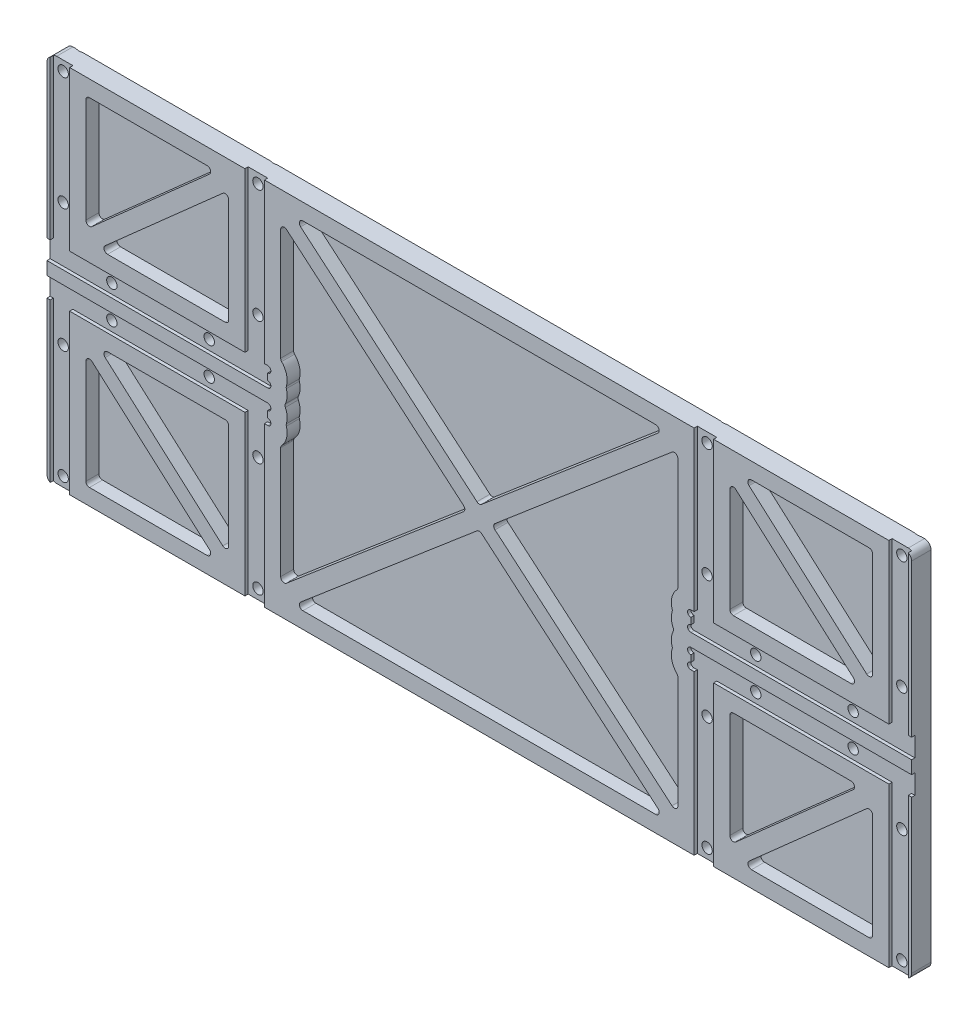
from build123d import *

# Parameters (mm, degrees)
SKETCH_1_W                   = 133.183849372
SKETCH_1_H                   = 57
EXTRUDE_1_DEPTH              = 6
CUT_EXTRUDE_1_DEPTH          = 1
HOLE_WIZARD_M3_1_D           = 3.2
HOLE_WIZARD_M3_1_CSINK_D     = 6.3
HOLE_WIZARD_M3_1_CSINK_ANGLE = 90
MIRROR_5_COPY_1_SKETCH_W     = 133.183849372
MIRROR_5_COPY_1_SKETCH_H     = 57
MIRROR_5_COPY_1_DEPTH        = 6
MIRROR_5_COPY_2_DEPTH        = 1
MIRROR_5_COPY_3_D            = 3.2
MIRROR_5_COPY_3_CSINK_D      = 6.3
MIRROR_5_COPY_3_CSINK_ANGLE  = 90
FILLET_1_R                   = 2
CUT_EXTRUDE_2_DEPTH          = 4
FILLET_2_R                   = 1.1


with BuildPart() as part:
    # ｽｹｯﾁ1 → ﾎﾞｽ - 押し出し1 (new body)
    with BuildSketch(Plane.XY):
        with Locations((-66.591924686, 28.5)):
            Rectangle(SKETCH_1_W, SKETCH_1_H)
    extrude_1 = extrude(amount=-EXTRUDE_1_DEPTH)

    # ｽｹｯﾁ1<3> → ｶｯﾄ - 押し出し1 (cut)
    with BuildSketch(Plane.XY):
        with BuildLine():
            Line((-126.183849372, 57), (-132.183849372, 57))
            Line((-132.183849372, 57), (-132.183849372, 8))
            Line((-132.183849372, 8), (-133.183849372, 8))
            Line((-133.183849372, 8), (-133.183849372, 2))
            Line((-133.183849372, 2), (-65.183849372, 2))
            ThreePointArc((-65.183849372, 2), (-64.183849372, 3), (-65.183849372, 4))
            Line((-65.183849372, 4), (-65.183849372, 6))
            ThreePointArc((-65.183849372, 6), (-64.183849372, 7), (-65.183849372, 8))
            Line((-65.183849372, 8), (-66.183849372, 8))
            Line((-66.183849372, 8), (-66.183849372, 57))
            Line((-66.183849372, 57), (-72.183849372, 57))
            Line((-72.183849372, 57), (-72.183849372, 8))
            Line((-72.183849372, 8), (-126.183849372, 8))
            Line((-126.183849372, 8), (-126.183849372, 57))
        make_face()
    cut_extrude_1 = extrude(amount=-CUT_EXTRUDE_1_DEPTH, mode=Mode.SUBTRACT)

    # M3 丸皿ねじ用皿穴1 (through all)
    with Locations(Plane(origin=(-129.183849372, 54, -6), x_dir=(-1, 0, 0), z_dir=(0, 0, -1))):
        with Locations((0, 0), (0, -35), (-15, -49), (-45, -49), (-60, -35), (-60, 0)):
            hole_wizard_m3_1 = CounterSinkHole(HOLE_WIZARD_M3_1_D / 2, HOLE_WIZARD_M3_1_CSINK_D / 2, counter_sink_angle=HOLE_WIZARD_M3_1_CSINK_ANGLE)

    # ﾐﾗｰ4: ﾎﾞｽ - 押し出し1, ｶｯﾄ - 押し出し1, M3 丸皿ねじ用皿穴1 across plane
    add(extrude_1.mirror(Plane.ZX))
    add(cut_extrude_1.mirror(Plane.ZX), mode=Mode.SUBTRACT)
    add(hole_wizard_m3_1.mirror(Plane.ZX), mode=Mode.SUBTRACT)

    # ﾐﾗｰ5: ﾎﾞｽ - 押し出し1, ｶｯﾄ - 押し出し1, M3 丸皿ねじ用皿穴1 across plane
    add(extrude_1.mirror(Plane(origin=(0, 0, 0), x_dir=(0, 0, 1), z_dir=(1, 0, 0))))
    add(cut_extrude_1.mirror(Plane(origin=(0, 0, 0), x_dir=(0, 0, 1), z_dir=(1, 0, 0))), mode=Mode.SUBTRACT)
    add(hole_wizard_m3_1.mirror(Plane(origin=(0, 0, 0), x_dir=(0, 0, 1), z_dir=(1, 0, 0))), mode=Mode.SUBTRACT)

    # ﾐﾗｰ5 copy 1 sketch → ﾐﾗｰ5 copy 1 (add)
    with BuildSketch(Plane(origin=(0, 0, 0), x_dir=(-1, 0, 0), z_dir=(0, 0, 1))):
        with Locations((-66.591924686, 28.5)):
            Rectangle(MIRROR_5_COPY_1_SKETCH_W, MIRROR_5_COPY_1_SKETCH_H)
    extrude(amount=-MIRROR_5_COPY_1_DEPTH)

    # ﾐﾗｰ5 copy 2 sketch → ﾐﾗｰ5 copy 2 (cut)
    with BuildSketch(Plane(origin=(0, 0, 0), x_dir=(-1, 0, 0), z_dir=(0, 0, 1))):
        with BuildLine():
            Line((-126.183849372, 57), (-132.183849372, 57))
            Line((-132.183849372, 57), (-132.183849372, 8))
            Line((-132.183849372, 8), (-133.183849372, 8))
            Line((-133.183849372, 8), (-133.183849372, 2))
            Line((-133.183849372, 2), (-65.183849372, 2))
            ThreePointArc((-65.183849372, 2), (-64.183849372, 3), (-65.183849372, 4))
            Line((-65.183849372, 4), (-65.183849372, 6))
            ThreePointArc((-65.183849372, 6), (-64.183849372, 7), (-65.183849372, 8))
            Line((-65.183849372, 8), (-66.183849372, 8))
            Line((-66.183849372, 8), (-66.183849372, 57))
            Line((-66.183849372, 57), (-72.183849372, 57))
            Line((-72.183849372, 57), (-72.183849372, 8))
            Line((-72.183849372, 8), (-126.183849372, 8))
            Line((-126.183849372, 8), (-126.183849372, 57))
        make_face()
    extrude(amount=-MIRROR_5_COPY_2_DEPTH, mode=Mode.SUBTRACT)

    # ﾐﾗｰ5 copy 3 (through all)
    with Locations(Plane(origin=(129.183849372, -54, -6), x_dir=(1, 0, 0), z_dir=(0, 0, -1))):
        with Locations((0, 0), (0, -35), (-15, -49), (-45, -49), (-60, -35), (-60, 0)):
            CounterSinkHole(MIRROR_5_COPY_3_D / 2, MIRROR_5_COPY_3_CSINK_D / 2, counter_sink_angle=MIRROR_5_COPY_3_CSINK_ANGLE)

    # ﾌｨﾚｯﾄ1
    fillet_1_edges = [part.edges().sort_by_distance(p)[0] for p in [
        (-133.183849372, -57, -3),
        (133.183849372, -57, -3),
        (133.183849372, 57, -3),
        (-133.183849372, 57, -3),
    ]]
    fillet(fillet_1_edges, radius=FILLET_1_R)

    # ｽｹｯﾁ3 → ｶｯﾄ - 押し出し2 (cut)
    with BuildSketch(Plane.XY):
        Polygon((-121.183849372, 52), (-121.183849372, 16.340696499), (-80.952840294, 52), align=None)
        Polygon((-77.183849372, 48.659303501), (-117.41485845, 13), (-77.183849372, 13), align=None)
        Polygon((-77.183849372, -48.659303501), (-77.183849372, -13), (-117.41485845, -13), align=None)
        Polygon((-121.183849372, -52), (-80.952840294, -52), (-121.183849372, -16.340696499), align=None)
        with BuildLine():
            Line((-3.860389348, 0), (-61.183849372, 48.719064783))
            Line((-61.183849372, 48.719064783), (-61.183849372, 11.472135955))
            ThreePointArc((-61.183849372, 11.472135955), (-59.371290172, 8.48800388), (-59.526995122, 5))
            ThreePointArc((-59.526995122, 5), (-59.209157877, 2.449489743), (-59.987696949, 0))
            ThreePointArc((-59.987696949, 0), (-59.209157877, -2.449489743), (-59.526995122, -5))
            ThreePointArc((-59.526995122, -5), (-59.371290172, -8.48800388), (-61.183849372, -11.472135955))
            Line((-61.183849372, -11.472135955), (-61.183849372, -48.719064783))
            Line((-61.183849372, -48.719064783), (-3.860389348, 0))
        make_face()
        Polygon((-57.323460024, 52), (0, 3.280935217), (57.323460024, 52), align=None)
        with BuildLine():
            Line((61.183849372, 48.719064783), (3.860389348, 0))
            Line((3.860389348, 0), (61.183849372, -48.719064783))
            Line((61.183849372, -48.719064783), (61.183849372, -11.472135955))
            ThreePointArc((61.183849372, -11.472135955), (59.371290172, -8.48800388), (59.526995122, -5))
            ThreePointArc((59.526995122, -5), (59.209157877, -2.449489743), (59.987696949, 0))
            ThreePointArc((59.987696949, 0), (59.209157877, 2.449489743), (59.526995122, 5))
            ThreePointArc((59.526995122, 5), (59.371290172, 8.48800388), (61.183849372, 11.472135955))
            Line((61.183849372, 11.472135955), (61.183849372, 48.719064783))
        make_face()
        Polygon((57.323460024, -52), (0, -3.280935217), (-57.323460024, -52), align=None)
        Polygon((77.183849372, 48.659303501), (77.183849372, 13), (117.41485845, 13), align=None)
        Polygon((121.183849372, 52), (80.952840294, 52), (121.183849372, 16.340696499), align=None)
        Polygon((77.183849372, -48.659303501), (117.41485845, -13), (77.183849372, -13), align=None)
        Polygon((121.183849372, -52), (121.183849372, -16.340696499), (80.952840294, -52), align=None)
    extrude(amount=-CUT_EXTRUDE_2_DEPTH, mode=Mode.SUBTRACT)

    # ﾌｨﾚｯﾄ2
    fillet_2_edges = [part.edges().sort_by_distance(p)[0] for p in [
        (59.987696949, 0, -2),
        (59.526995122, -5, -2),
        (61.183849372, -11.472135955, -2),
        (61.183849372, -48.719064783, -2),
        (3.860389348, 0, -2),
        (61.183849372, 48.719064783, -2),
        (61.183849372, 11.472135955, -2),
        (59.526995122, 5, -2),
        (57.323460024, 52, -2),
        (0, 3.280935217, -2),
        (-57.323460024, 52, -2),
        (-57.323460024, -52, -2),
        (0, -3.280935217, -2),
        (57.323460024, -52, -2),
        (117.41485845, 13, -2),
        (77.183849372, 13, -2),
        (77.183849372, 48.659303501, -2),
        (-77.183849372, 13, -2),
        (-117.41485845, 13, -2),
        (-77.183849372, 48.659303501, -2),
        (-117.41485845, -13, -2),
        (-77.183849372, -13, -2),
        (-77.183849372, -48.659303501, -2),
        (-121.183849372, -16.340696499, -2),
        (-80.952840294, -52, -2),
        (-121.183849372, -52, -2),
        (-61.183849372, -11.472135955, -2),
        (-59.526995122, -5, -2),
        (-59.987696949, 0, -2),
        (-59.526995122, 5, -2),
        (-61.183849372, 11.472135955, -2),
        (-61.183849372, 48.719064783, -2),
        (-3.860389348, 0, -2),
        (-61.183849372, -48.719064783, -2),
        (121.183849372, -52, -2),
        (80.952840294, -52, -2),
        (121.183849372, -16.340696499, -2),
        (77.183849372, -13, -2),
        (117.41485845, -13, -2),
        (77.183849372, -48.659303501, -2),
        (121.183849372, 16.340696499, -2),
        (80.952840294, 52, -2),
        (121.183849372, 52, -2),
        (-121.183849372, 52, -2),
        (-80.952840294, 52, -2),
        (-121.183849372, 16.340696499, -2),
    ]]
    fillet(fillet_2_edges, radius=FILLET_2_R)


solid = part.part
